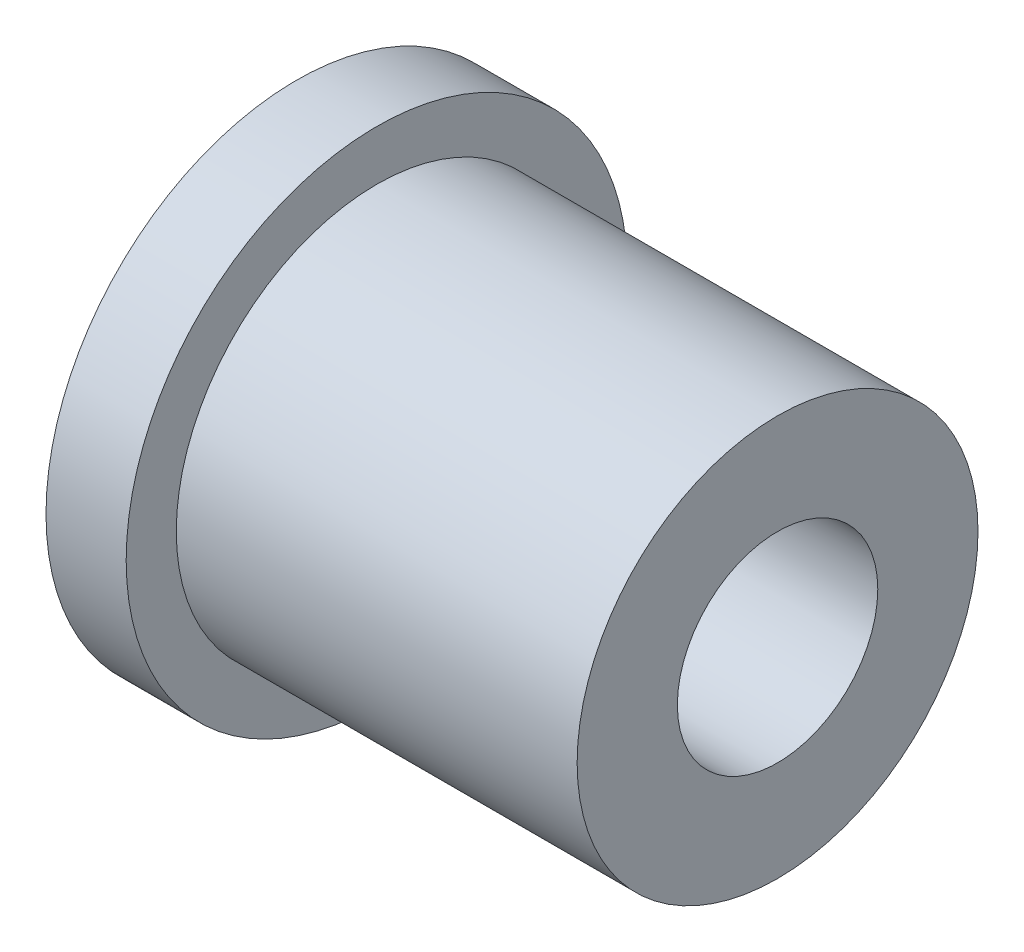
from build123d import *


with BuildPart() as part:
    # Sketch1 → Revolve1 (revolve)
    with BuildSketch(Plane.XY, mode=Mode.PRIVATE) as revolve1_sk:
        Polygon((0, 3.175), (0, 7.9375), (2.54, 7.9375), (2.54, 6.35), (15.24, 6.35), (15.24, 3.175), align=None)
    revolve(revolve1_sk.sketch.rotate(Axis((0, 0, 0), (1, 0, 0)), 90), axis=Axis((0, 0, 0), (1, 0, 0)))


solid = part.part
